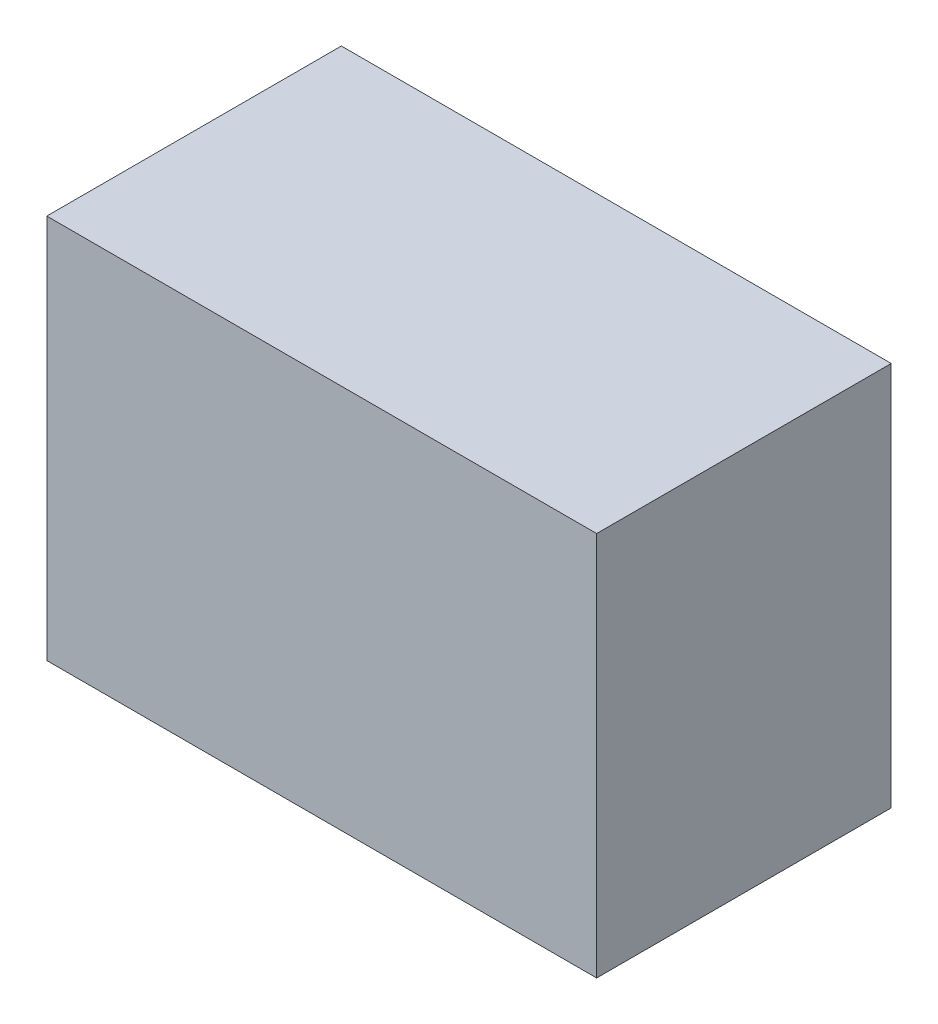
from build123d import *

# Parameters (mm, degrees)
SKETCH1_W           = 140
SKETCH1_H           = 75
BOSS_EXTRUDE1_DEPTH = 49


with BuildPart() as part:
    # Sketch1 → Boss-Extrude1 (new, symmetric)
    with BuildSketch(Plane(origin=(0, 0, 0), x_dir=(1, 0, 0), z_dir=(0, 1, 0))):
        Rectangle(SKETCH1_W, SKETCH1_H)
    extrude(amount=BOSS_EXTRUDE1_DEPTH, both=True)


solid = part.part
